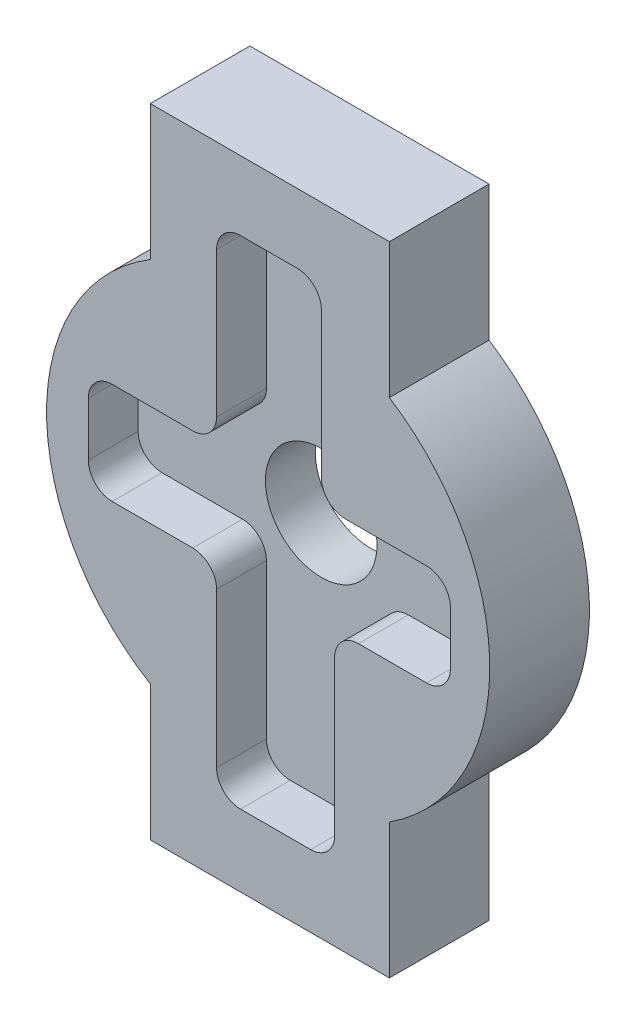
from build123d import *

# Parameters (mm, degrees)
SKETCH1_R           = 2.8
BOSS_EXTRUDE1_DEPTH = 5
CUT_EXTRUDE1_DEPTH  = 2.5
FILLET1_R           = 1.2


with BuildPart() as part:
    # Sketch1 → Boss-Extrude1 (new body)
    with BuildSketch(Plane.XY.offset(10)):
        with BuildLine():
            Line((-253, 240), (-241, 240))
            Line((-241, 240), (-241, 233.219543457))
            ThreePointArc((-241, 233.219543457), (-235.964643127, 224), (-241, 214.780456543))
            Line((-241, 214.780456543), (-241, 208))
            Line((-241, 208), (-253, 208))
            Line((-253, 208), (-253, 214.780456543))
            ThreePointArc((-253, 214.780456543), (-258.20228405, 224), (-253, 233.219543457))
            Line((-253, 233.219543457), (-253, 240))
        make_face()
        with Locations((-246.922635101, 224)):
            Circle(SKETCH1_R, mode=Mode.SUBTRACT)
    extrude(amount=BOSS_EXTRUDE1_DEPTH)

    # Sketch2 → Cut-Extrude1 (cut)
    with BuildSketch(Plane.XY.offset(15)):
        Polygon((-249.671711, 236.526764937), (-244.414971283, 236.526764937), (-244.414971283, 226.843297037), (-237.940881316, 226.843297037), (-237.940881316, 221.752559627), (-243.750962055, 221.752559627), (-243.750962055, 211.604094919), (-249.671711, 211.604094919), (-249.671711, 221.752559627), (-256.108895334, 221.752559627), (-256.108895334, 226.843297037), (-249.671711, 226.843297037), align=None)
    extrude(amount=-CUT_EXTRUDE1_DEPTH, mode=Mode.SUBTRACT)

    # Fillet1
    fillet1_edges = [part.edges().sort_by_distance(p)[0] for p in [
        (-249.671711, 226.843297037, 13.75),
        (-249.671711, 236.526764937, 13.75),
        (-244.414971283, 236.526764937, 13.75),
        (-244.414971283, 226.843297037, 13.75),
        (-237.940881316, 226.843297037, 13.75),
        (-237.940881316, 221.752559627, 13.75),
        (-243.750962055, 221.752559627, 13.75),
        (-243.750962055, 211.604094919, 13.75),
        (-249.671711, 211.604094919, 13.75),
        (-249.671711, 221.752559627, 13.75),
        (-256.108895334, 221.752559627, 13.75),
        (-256.108895334, 226.843297037, 13.75),
    ]]
    fillet(fillet1_edges, radius=FILLET1_R)


solid = part.part
